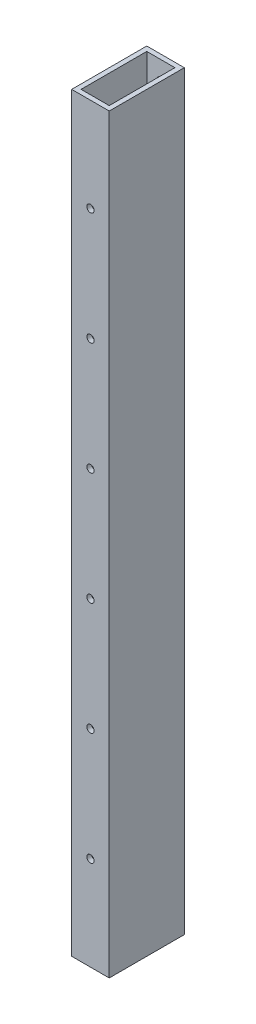
from build123d import *

# Parameters (mm, degrees)
SKETCH1_W           = 25.4
SKETCH1_H           = 50.8
SKETCH1_W_2         = 19.05
SKETCH1_H_2         = 44.45
BOSS_EXTRUDE1_DEPTH = 508
CUT_EXTRUDE1_REACH  = 513.165
SKETCH2_R           = 2.4638
CUT_EXTRUDE2_REACH  = 513.165
SKETCH3_R           = 2.4638
CUT_EXTRUDE3_REACH  = 513.165
SKETCH4_R           = 2.5796875


with BuildPart() as part:
    # Sketch1 → Boss-Extrude1 (new body)
    with BuildSketch(Plane(origin=(0, 0, 0), x_dir=(1, 0, 0), z_dir=(0, 1, 0))):
        with Locations((12.7, 25.4)):
            Rectangle(SKETCH1_W, SKETCH1_H)
        with Locations((12.7, 25.4)):
            Rectangle(SKETCH1_W_2, SKETCH1_H_2, mode=Mode.SUBTRACT)
    extrude(amount=BOSS_EXTRUDE1_DEPTH)

    # Sketch2 → Cut-Extrude1 (cut, up to next)
    with BuildSketch(Plane(origin=(0, 0, -50.8), x_dir=(-1, 0, 0), z_dir=(0, 0, -1)), mode=Mode.PRIVATE) as cut_extrude1_sk1:
        with Locations((-12.7, 12.7)):
            Circle(SKETCH2_R)
    cut_extrude1_tool1 = extrude(cut_extrude1_sk1.sketch, amount=-CUT_EXTRUDE1_REACH, mode=Mode.PRIVATE) & part.part
    # Sketch2 → Cut-Extrude1 (cut, up to next)
    with BuildSketch(Plane(origin=(0, 0, -50.8), x_dir=(-1, 0, 0), z_dir=(0, 0, -1)), mode=Mode.PRIVATE) as cut_extrude1_sk2:
        with Locations((-12.7, 50.8)):
            Circle(SKETCH2_R)
    cut_extrude1_tool2 = extrude(cut_extrude1_sk2.sketch, amount=-CUT_EXTRUDE1_REACH, mode=Mode.PRIVATE) & part.part
    # Sketch2 → Cut-Extrude1 (cut, up to next)
    with BuildSketch(Plane(origin=(0, 0, -50.8), x_dir=(-1, 0, 0), z_dir=(0, 0, -1)), mode=Mode.PRIVATE) as cut_extrude1_sk3:
        with Locations((-12.7, 177.8)):
            Circle(SKETCH2_R)
    cut_extrude1_tool3 = extrude(cut_extrude1_sk3.sketch, amount=-CUT_EXTRUDE1_REACH, mode=Mode.PRIVATE) & part.part
    # Sketch2 → Cut-Extrude1 (cut, up to next)
    with BuildSketch(Plane(origin=(0, 0, -50.8), x_dir=(-1, 0, 0), z_dir=(0, 0, -1)), mode=Mode.PRIVATE) as cut_extrude1_sk4:
        with Locations((-12.7, 215.9)):
            Circle(SKETCH2_R)
    cut_extrude1_tool4 = extrude(cut_extrude1_sk4.sketch, amount=-CUT_EXTRUDE1_REACH, mode=Mode.PRIVATE) & part.part
    # Sketch2 → Cut-Extrude1 (cut, up to next)
    with BuildSketch(Plane(origin=(0, 0, -50.8), x_dir=(-1, 0, 0), z_dir=(0, 0, -1)), mode=Mode.PRIVATE) as cut_extrude1_sk5:
        with Locations((-12.7, 241.3)):
            Circle(SKETCH2_R)
    cut_extrude1_tool5 = extrude(cut_extrude1_sk5.sketch, amount=-CUT_EXTRUDE1_REACH, mode=Mode.PRIVATE) & part.part
    # Sketch2 → Cut-Extrude1 (cut, up to next)
    with BuildSketch(Plane(origin=(0, 0, -50.8), x_dir=(-1, 0, 0), z_dir=(0, 0, -1)), mode=Mode.PRIVATE) as cut_extrude1_sk6:
        with Locations((-12.7, 266.7)):
            Circle(SKETCH2_R)
    cut_extrude1_tool6 = extrude(cut_extrude1_sk6.sketch, amount=-CUT_EXTRUDE1_REACH, mode=Mode.PRIVATE) & part.part
    # Sketch2 → Cut-Extrude1 (cut, up to next)
    with BuildSketch(Plane(origin=(0, 0, -50.8), x_dir=(-1, 0, 0), z_dir=(0, 0, -1)), mode=Mode.PRIVATE) as cut_extrude1_sk7:
        with Locations((-12.7, 292.1)):
            Circle(SKETCH2_R)
    cut_extrude1_tool7 = extrude(cut_extrude1_sk7.sketch, amount=-CUT_EXTRUDE1_REACH, mode=Mode.PRIVATE) & part.part
    # Sketch2 → Cut-Extrude1 (cut, up to next)
    with BuildSketch(Plane(origin=(0, 0, -50.8), x_dir=(-1, 0, 0), z_dir=(0, 0, -1)), mode=Mode.PRIVATE) as cut_extrude1_sk8:
        with Locations((-12.7, 330.2)):
            Circle(SKETCH2_R)
    cut_extrude1_tool8 = extrude(cut_extrude1_sk8.sketch, amount=-CUT_EXTRUDE1_REACH, mode=Mode.PRIVATE) & part.part
    # Sketch2 → Cut-Extrude1 (cut, up to next)
    with BuildSketch(Plane(origin=(0, 0, -50.8), x_dir=(-1, 0, 0), z_dir=(0, 0, -1)), mode=Mode.PRIVATE) as cut_extrude1_sk9:
        with Locations((-12.7, 457.2)):
            Circle(SKETCH2_R)
    cut_extrude1_tool9 = extrude(cut_extrude1_sk9.sketch, amount=-CUT_EXTRUDE1_REACH, mode=Mode.PRIVATE) & part.part
    # Sketch2 → Cut-Extrude1 (cut, up to next)
    with BuildSketch(Plane(origin=(0, 0, -50.8), x_dir=(-1, 0, 0), z_dir=(0, 0, -1)), mode=Mode.PRIVATE) as cut_extrude1_sk10:
        with Locations((-12.7, 495.3)):
            Circle(SKETCH2_R)
    cut_extrude1_tool10 = extrude(cut_extrude1_sk10.sketch, amount=-CUT_EXTRUDE1_REACH, mode=Mode.PRIVATE) & part.part
    add(cut_extrude1_tool1.solids().sort_by_distance((12.7, 12.7, -50.8))[0], mode=Mode.SUBTRACT)
    add(cut_extrude1_tool2.solids().sort_by_distance((12.7, 50.8, -50.8))[0], mode=Mode.SUBTRACT)
    add(cut_extrude1_tool3.solids().sort_by_distance((12.7, 177.8, -50.8))[0], mode=Mode.SUBTRACT)
    add(cut_extrude1_tool4.solids().sort_by_distance((12.7, 215.9, -50.8))[0], mode=Mode.SUBTRACT)
    add(cut_extrude1_tool5.solids().sort_by_distance((12.7, 241.3, -50.8))[0], mode=Mode.SUBTRACT)
    add(cut_extrude1_tool6.solids().sort_by_distance((12.7, 266.7, -50.8))[0], mode=Mode.SUBTRACT)
    add(cut_extrude1_tool7.solids().sort_by_distance((12.7, 292.1, -50.8))[0], mode=Mode.SUBTRACT)
    add(cut_extrude1_tool8.solids().sort_by_distance((12.7, 330.2, -50.8))[0], mode=Mode.SUBTRACT)
    add(cut_extrude1_tool9.solids().sort_by_distance((12.7, 457.2, -50.8))[0], mode=Mode.SUBTRACT)
    add(cut_extrude1_tool10.solids().sort_by_distance((12.7, 495.3, -50.8))[0], mode=Mode.SUBTRACT)

    # Sketch3 → Cut-Extrude2 (cut, up to next)
    with BuildSketch(Plane.XY, mode=Mode.PRIVATE) as cut_extrude2_sk1:
        with Locations((12.7, 63.5)):
            Circle(SKETCH3_R)
    cut_extrude2_tool1 = extrude(cut_extrude2_sk1.sketch, amount=-CUT_EXTRUDE2_REACH, mode=Mode.PRIVATE) & part.part
    # Sketch3 → Cut-Extrude2 (cut, up to next)
    with BuildSketch(Plane.XY, mode=Mode.PRIVATE) as cut_extrude2_sk2:
        with Locations((12.7, 139.7)):
            Circle(SKETCH3_R)
    cut_extrude2_tool2 = extrude(cut_extrude2_sk2.sketch, amount=-CUT_EXTRUDE2_REACH, mode=Mode.PRIVATE) & part.part
    # Sketch3 → Cut-Extrude2 (cut, up to next)
    with BuildSketch(Plane.XY, mode=Mode.PRIVATE) as cut_extrude2_sk3:
        with Locations(Location((12.7, 215.9, 0), (0, 0, 180))):
            Circle(SKETCH3_R)
    cut_extrude2_tool3 = extrude(cut_extrude2_sk3.sketch, amount=-CUT_EXTRUDE2_REACH, mode=Mode.PRIVATE) & part.part
    # Sketch3 → Cut-Extrude2 (cut, up to next)
    with BuildSketch(Plane.XY, mode=Mode.PRIVATE) as cut_extrude2_sk4:
        with Locations(Location((12.7, 292.1, 0), (0, 0, 180))):
            Circle(SKETCH3_R)
    cut_extrude2_tool4 = extrude(cut_extrude2_sk4.sketch, amount=-CUT_EXTRUDE2_REACH, mode=Mode.PRIVATE) & part.part
    # Sketch3 → Cut-Extrude2 (cut, up to next)
    with BuildSketch(Plane.XY, mode=Mode.PRIVATE) as cut_extrude2_sk5:
        with Locations((12.7, 368.3)):
            Circle(SKETCH3_R)
    cut_extrude2_tool5 = extrude(cut_extrude2_sk5.sketch, amount=-CUT_EXTRUDE2_REACH, mode=Mode.PRIVATE) & part.part
    # Sketch3 → Cut-Extrude2 (cut, up to next)
    with BuildSketch(Plane.XY, mode=Mode.PRIVATE) as cut_extrude2_sk6:
        with Locations((12.7, 444.5)):
            Circle(SKETCH3_R)
    cut_extrude2_tool6 = extrude(cut_extrude2_sk6.sketch, amount=-CUT_EXTRUDE2_REACH, mode=Mode.PRIVATE) & part.part
    add(cut_extrude2_tool1.solids().sort_by_distance((12.7, 63.5, 0))[0], mode=Mode.SUBTRACT)
    add(cut_extrude2_tool2.solids().sort_by_distance((12.7, 139.7, 0))[0], mode=Mode.SUBTRACT)
    add(cut_extrude2_tool3.solids().sort_by_distance((12.7, 215.9, 0))[0], mode=Mode.SUBTRACT)
    add(cut_extrude2_tool4.solids().sort_by_distance((12.7, 292.1, 0))[0], mode=Mode.SUBTRACT)
    add(cut_extrude2_tool5.solids().sort_by_distance((12.7, 368.3, 0))[0], mode=Mode.SUBTRACT)
    add(cut_extrude2_tool6.solids().sort_by_distance((12.7, 444.5, 0))[0], mode=Mode.SUBTRACT)

    # Sketch4 → Cut-Extrude3 (cut, up to next)
    with BuildSketch(Plane.ZY, mode=Mode.PRIVATE) as cut_extrude3_sk1:
        with Locations((-38.110518668, 96.635101662)):
            Circle(SKETCH4_R)
    cut_extrude3_tool1 = extrude(cut_extrude3_sk1.sketch, amount=-CUT_EXTRUDE3_REACH, mode=Mode.PRIVATE) & part.part
    # Sketch4 → Cut-Extrude3 (cut, up to next)
    with BuildSketch(Plane.ZY, mode=Mode.PRIVATE) as cut_extrude3_sk2:
        with Locations((-38.110518668, 411.364898332)):
            Circle(SKETCH4_R)
    cut_extrude3_tool2 = extrude(cut_extrude3_sk2.sketch, amount=-CUT_EXTRUDE3_REACH, mode=Mode.PRIVATE) & part.part
    # Sketch4 → Cut-Extrude3 (cut, up to next)
    with BuildSketch(Plane.ZY, mode=Mode.PRIVATE) as cut_extrude3_sk3:
        with Locations((-12.710518668, 411.364898332)):
            Circle(SKETCH4_R)
    cut_extrude3_tool3 = extrude(cut_extrude3_sk3.sketch, amount=-CUT_EXTRUDE3_REACH, mode=Mode.PRIVATE) & part.part
    # Sketch4 → Cut-Extrude3 (cut, up to next)
    with BuildSketch(Plane.ZY, mode=Mode.PRIVATE) as cut_extrude3_sk4:
        with Locations((-12.710518668, 96.635101662)):
            Circle(SKETCH4_R)
    cut_extrude3_tool4 = extrude(cut_extrude3_sk4.sketch, amount=-CUT_EXTRUDE3_REACH, mode=Mode.PRIVATE) & part.part
    add(cut_extrude3_tool1.solids().sort_by_distance((0, 96.635102, -38.110519))[0], mode=Mode.SUBTRACT)
    add(cut_extrude3_tool2.solids().sort_by_distance((0, 411.364898, -38.110519))[0], mode=Mode.SUBTRACT)
    add(cut_extrude3_tool3.solids().sort_by_distance((0, 411.364898, -12.710519))[0], mode=Mode.SUBTRACT)
    add(cut_extrude3_tool4.solids().sort_by_distance((0, 96.635102, -12.710519))[0], mode=Mode.SUBTRACT)


solid = part.part
